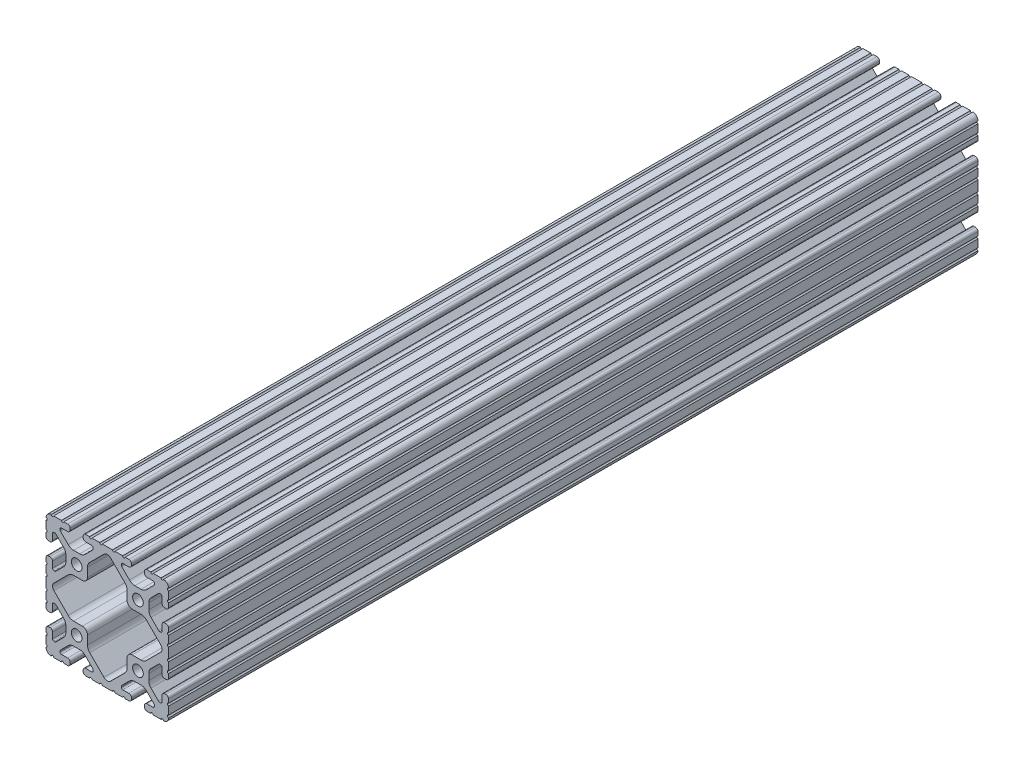
from build123d import *

# Parameters (mm, degrees)
SKETCH1_R           = 3.3274
BOSS_EXTRUDE1_DEPTH = 503.174


with BuildPart() as part:
    # Sketch1 → Boss-Extrude1 (new body)
    with BuildSketch(Plane.XY):
        with BuildLine():
            Line((-38.1, 3.2004), (-38.1, -3.2004))
            ThreePointArc((-38.1, -3.2004), (-37.338, -3.9624), (-38.1, -4.7244))
            Line((-38.1, -4.7244), (-38.1, -9.5504))
            ThreePointArc((-38.1, -9.5504), (-37.338, -10.3124), (-38.1, -11.0744))
            Line((-38.1, -11.0744), (-38.1, -13.4112))
            ThreePointArc((-38.1, -13.4112), (-37.638751759, -14.524751759), (-36.5252, -14.986))
            Line((-36.5252, -14.986), (-35.6108, -14.986))
            ThreePointArc((-35.6108, -14.986), (-34.497248241, -14.524751759), (-34.036, -13.4112))
            Line((-34.036, -13.4112), (-34.036, -9.652))
            ThreePointArc((-34.036, -9.652), (-33.775617928, -9.023382072), (-33.147, -8.763))
            Line((-33.147, -8.763), (-32.578918, -8.763))
            ThreePointArc((-32.578918, -8.763), (-32.238712428, -8.830671096), (-31.950300071, -9.023382072))
            Line((-31.950300071, -9.023382072), (-27.179198975, -13.794483168))
            ThreePointArc((-27.179198975, -13.794483168), (-26.14957176, -15.33542919), (-25.788014764, -17.153098957))
            Line((-25.788014764, -17.153098957), (-25.788014764, -20.946901043))
            ThreePointArc((-25.788014764, -20.946901043), (-26.14957176, -22.76457081), (-27.179198975, -24.305516832))
            Line((-27.179198975, -24.305516832), (-31.950300071, -29.076617928))
            ThreePointArc((-31.950300071, -29.076617928), (-32.238712428, -29.269328904), (-32.578918, -29.337))
            Line((-32.578918, -29.337), (-33.147, -29.337))
            ThreePointArc((-33.147, -29.337), (-33.775617928, -29.076617928), (-34.036, -28.448))
            Line((-34.036, -28.448), (-34.036, -24.6888))
            ThreePointArc((-34.036, -24.6888), (-34.497248241, -23.575248241), (-35.6108, -23.114))
            Line((-35.6108, -23.114), (-36.5252, -23.114))
            ThreePointArc((-36.5252, -23.114), (-37.638751759, -23.575248241), (-38.1, -24.6888))
            Line((-38.1, -24.6888), (-38.1, -27.0256))
            ThreePointArc((-38.1, -27.0256), (-37.338, -27.7876), (-38.1, -28.5496))
            Line((-38.1, -28.5496), (-38.1, -33.3756))
            ThreePointArc((-38.1, -33.3756), (-37.338, -34.1376), (-38.1, -34.8996))
            Line((-38.1, -34.8996), (-38.1, -34.925))
            ThreePointArc((-38.1, -34.925), (-37.17006403, -37.17006403), (-34.925, -38.1))
            Line((-34.925, -38.1), (-34.8996, -38.1))
            ThreePointArc((-34.8996, -38.1), (-34.1376, -37.338), (-33.3756, -38.1))
            Line((-33.3756, -38.1), (-28.5496, -38.1))
            ThreePointArc((-28.5496, -38.1), (-27.7876, -37.338), (-27.0256, -38.1))
            Line((-27.0256, -38.1), (-24.6888, -38.1))
            ThreePointArc((-24.6888, -38.1), (-23.575248241, -37.638751759), (-23.114, -36.5252))
            Line((-23.114, -36.5252), (-23.114, -35.6108))
            ThreePointArc((-23.114, -35.6108), (-23.575248241, -34.497248241), (-24.6888, -34.036))
            Line((-24.6888, -34.036), (-28.448, -34.036))
            ThreePointArc((-28.448, -34.036), (-29.076617928, -33.775617928), (-29.337, -33.147))
            Line((-29.337, -33.147), (-29.337, -32.578918))
            ThreePointArc((-29.337, -32.578918), (-29.269328904, -32.238712428), (-29.076617928, -31.950300071))
            Line((-29.076617928, -31.950300071), (-24.305516832, -27.179198975))
            ThreePointArc((-24.305516832, -27.179198975), (-22.76457081, -26.14957176), (-20.946901043, -25.788014764))
            Line((-20.946901043, -25.788014764), (-17.153098957, -25.788014764))
            ThreePointArc((-17.153098957, -25.788014764), (-15.33542919, -26.14957176), (-13.794483168, -27.179198975))
            Line((-13.794483168, -27.179198975), (-9.023382072, -31.950300071))
            ThreePointArc((-9.023382072, -31.950300071), (-8.830671096, -32.238712428), (-8.763, -32.578918))
            Line((-8.763, -32.578918), (-8.763, -33.147))
            ThreePointArc((-8.763, -33.147), (-9.023382072, -33.775617928), (-9.652, -34.036))
            Line((-9.652, -34.036), (-13.4112, -34.036))
            ThreePointArc((-13.4112, -34.036), (-14.524751759, -34.497248241), (-14.986, -35.6108))
            Line((-14.986, -35.6108), (-14.986, -36.5252))
            ThreePointArc((-14.986, -36.5252), (-14.524751759, -37.638751759), (-13.4112, -38.1))
            Line((-13.4112, -38.1), (-11.0744, -38.1))
            ThreePointArc((-11.0744, -38.1), (-10.3124, -37.338), (-9.5504, -38.1))
            Line((-9.5504, -38.1), (-4.7244, -38.1))
            ThreePointArc((-4.7244, -38.1), (-3.9624, -37.338), (-3.2004, -38.1))
            Line((-3.2004, -38.1), (3.2004, -38.1))
            ThreePointArc((3.2004, -38.1), (3.9624, -37.338), (4.7244, -38.1))
            Line((4.7244, -38.1), (9.5504, -38.1))
            ThreePointArc((9.5504, -38.1), (10.3124, -37.338), (11.0744, -38.1))
            Line((11.0744, -38.1), (13.4112, -38.1))
            ThreePointArc((13.4112, -38.1), (14.524751759, -37.638751759), (14.986, -36.5252))
            Line((14.986, -36.5252), (14.986, -35.6108))
            ThreePointArc((14.986, -35.6108), (14.524751759, -34.497248241), (13.4112, -34.036))
            Line((13.4112, -34.036), (9.652, -34.036))
            ThreePointArc((9.652, -34.036), (9.023382072, -33.775617928), (8.763, -33.147))
            Line((8.763, -33.147), (8.763, -32.578918))
            ThreePointArc((8.763, -32.578918), (8.830671096, -32.238712428), (9.023382072, -31.950300071))
            Line((9.023382072, -31.950300071), (13.794483168, -27.179198975))
            ThreePointArc((13.794483168, -27.179198975), (15.33542919, -26.14957176), (17.153098957, -25.788014764))
            Line((17.153098957, -25.788014764), (20.946901043, -25.788014764))
            ThreePointArc((20.946901043, -25.788014764), (22.76457081, -26.14957176), (24.305516832, -27.179198975))
            Line((24.305516832, -27.179198975), (29.076617928, -31.950300071))
            ThreePointArc((29.076617928, -31.950300071), (29.269328904, -32.238712428), (29.337, -32.578918))
            Line((29.337, -32.578918), (29.337, -33.147))
            ThreePointArc((29.337, -33.147), (29.076617928, -33.775617928), (28.448, -34.036))
            Line((28.448, -34.036), (24.6888, -34.036))
            ThreePointArc((24.6888, -34.036), (23.575248241, -34.497248241), (23.114, -35.6108))
            Line((23.114, -35.6108), (23.114, -36.5252))
            ThreePointArc((23.114, -36.5252), (23.575248241, -37.638751759), (24.6888, -38.1))
            Line((24.6888, -38.1), (27.0256, -38.1))
            ThreePointArc((27.0256, -38.1), (27.7876, -37.338), (28.5496, -38.1))
            Line((28.5496, -38.1), (33.3756, -38.1))
            ThreePointArc((33.3756, -38.1), (34.1376, -37.338), (34.8996, -38.1))
            Line((34.8996, -38.1), (34.925, -38.1))
            ThreePointArc((34.925, -38.1), (37.17006403, -37.17006403), (38.1, -34.925))
            Line((38.1, -34.925), (38.1, -34.8996))
            ThreePointArc((38.1, -34.8996), (37.338, -34.1376), (38.1, -33.3756))
            Line((38.1, -33.3756), (38.1, -28.5496))
            ThreePointArc((38.1, -28.5496), (37.338, -27.7876), (38.1, -27.0256))
            Line((38.1, -27.0256), (38.1, -24.6888))
            ThreePointArc((38.1, -24.6888), (37.638751759, -23.575248241), (36.5252, -23.114))
            Line((36.5252, -23.114), (35.6108, -23.114))
            ThreePointArc((35.6108, -23.114), (34.497248241, -23.575248241), (34.036, -24.6888))
            Line((34.036, -24.6888), (34.036, -28.448))
            ThreePointArc((34.036, -28.448), (33.775617928, -29.076617928), (33.147, -29.337))
            Line((33.147, -29.337), (32.578918, -29.337))
            ThreePointArc((32.578918, -29.337), (32.238712428, -29.269328904), (31.950300071, -29.076617928))
            Line((31.950300071, -29.076617928), (27.179198975, -24.305516832))
            ThreePointArc((27.179198975, -24.305516832), (26.14957176, -22.76457081), (25.788014764, -20.946901043))
            Line((25.788014764, -20.946901043), (25.788014764, -17.153098957))
            ThreePointArc((25.788014764, -17.153098957), (26.14957176, -15.33542919), (27.179198975, -13.794483168))
            Line((27.179198975, -13.794483168), (31.950300071, -9.023382072))
            ThreePointArc((31.950300071, -9.023382072), (32.238712428, -8.830671096), (32.578918, -8.763))
            Line((32.578918, -8.763), (33.147, -8.763))
            ThreePointArc((33.147, -8.763), (33.775617928, -9.023382072), (34.036, -9.652))
            Line((34.036, -9.652), (34.036, -13.4112))
            ThreePointArc((34.036, -13.4112), (34.497248241, -14.524751759), (35.6108, -14.986))
            Line((35.6108, -14.986), (36.5252, -14.986))
            ThreePointArc((36.5252, -14.986), (37.638751759, -14.524751759), (38.1, -13.4112))
            Line((38.1, -13.4112), (38.1, -11.0744))
            ThreePointArc((38.1, -11.0744), (37.338, -10.3124), (38.1, -9.5504))
            Line((38.1, -9.5504), (38.1, -4.7244))
            ThreePointArc((38.1, -4.7244), (37.338, -3.9624), (38.1, -3.2004))
            Line((38.1, -3.2004), (38.1, 3.2004))
            ThreePointArc((38.1, 3.2004), (37.338, 3.9624), (38.1, 4.7244))
            Line((38.1, 4.7244), (38.1, 9.5504))
            ThreePointArc((38.1, 9.5504), (37.338, 10.3124), (38.1, 11.0744))
            Line((38.1, 11.0744), (38.1, 13.4112))
            ThreePointArc((38.1, 13.4112), (37.638751759, 14.524751759), (36.5252, 14.986))
            Line((36.5252, 14.986), (35.6108, 14.986))
            ThreePointArc((35.6108, 14.986), (34.497248241, 14.524751759), (34.036, 13.4112))
            Line((34.036, 13.4112), (34.036, 9.652))
            ThreePointArc((34.036, 9.652), (33.775617928, 9.023382072), (33.147, 8.763))
            Line((33.147, 8.763), (32.578918, 8.763))
            ThreePointArc((32.578918, 8.763), (32.238712428, 8.830671096), (31.950300071, 9.023382072))
            Line((31.950300071, 9.023382072), (27.179198975, 13.794483168))
            ThreePointArc((27.179198975, 13.794483168), (26.14957176, 15.33542919), (25.788014764, 17.153098957))
            Line((25.788014764, 17.153098957), (25.788014764, 20.946901043))
            ThreePointArc((25.788014764, 20.946901043), (26.14957176, 22.76457081), (27.179198975, 24.305516832))
            Line((27.179198975, 24.305516832), (31.950300071, 29.076617928))
            ThreePointArc((31.950300071, 29.076617928), (32.238712428, 29.269328904), (32.578918, 29.337))
            Line((32.578918, 29.337), (33.147, 29.337))
            ThreePointArc((33.147, 29.337), (33.775617928, 29.076617928), (34.036, 28.448))
            Line((34.036, 28.448), (34.036, 24.6888))
            ThreePointArc((34.036, 24.6888), (34.497248241, 23.575248241), (35.6108, 23.114))
            Line((35.6108, 23.114), (36.5252, 23.114))
            ThreePointArc((36.5252, 23.114), (37.638751759, 23.575248241), (38.1, 24.6888))
            Line((38.1, 24.6888), (38.1, 27.0256))
            ThreePointArc((38.1, 27.0256), (37.338, 27.7876), (38.1, 28.5496))
            Line((38.1, 28.5496), (38.1, 33.3756))
            ThreePointArc((38.1, 33.3756), (37.338, 34.1376), (38.1, 34.8996))
            Line((38.1, 34.8996), (38.1, 34.925))
            ThreePointArc((38.1, 34.925), (37.17006403, 37.17006403), (34.925, 38.1))
            Line((34.925, 38.1), (34.8996, 38.1))
            ThreePointArc((34.8996, 38.1), (34.1376, 37.338), (33.3756, 38.1))
            Line((33.3756, 38.1), (28.5496, 38.1))
            ThreePointArc((28.5496, 38.1), (27.7876, 37.338), (27.0256, 38.1))
            Line((27.0256, 38.1), (24.6888, 38.1))
            ThreePointArc((24.6888, 38.1), (23.575248241, 37.638751759), (23.114, 36.5252))
            Line((23.114, 36.5252), (23.114, 35.6108))
            ThreePointArc((23.114, 35.6108), (23.575248241, 34.497248241), (24.6888, 34.036))
            Line((24.6888, 34.036), (28.448, 34.036))
            ThreePointArc((28.448, 34.036), (29.076617928, 33.775617928), (29.337, 33.147))
            Line((29.337, 33.147), (29.337, 32.578918))
            ThreePointArc((29.337, 32.578918), (29.269328904, 32.238712428), (29.076617928, 31.950300071))
            Line((29.076617928, 31.950300071), (24.305516832, 27.179198975))
            ThreePointArc((24.305516832, 27.179198975), (22.76457081, 26.14957176), (20.946901043, 25.788014764))
            Line((20.946901043, 25.788014764), (17.153098957, 25.788014764))
            ThreePointArc((17.153098957, 25.788014764), (15.33542919, 26.14957176), (13.794483168, 27.179198975))
            Line((13.794483168, 27.179198975), (9.023382072, 31.950300071))
            ThreePointArc((9.023382072, 31.950300071), (8.830671096, 32.238712428), (8.763, 32.578918))
            Line((8.763, 32.578918), (8.763, 33.147))
            ThreePointArc((8.763, 33.147), (9.023382072, 33.775617928), (9.652, 34.036))
            Line((9.652, 34.036), (13.4112, 34.036))
            ThreePointArc((13.4112, 34.036), (14.524751759, 34.497248241), (14.986, 35.6108))
            Line((14.986, 35.6108), (14.986, 36.5252))
            ThreePointArc((14.986, 36.5252), (14.524751759, 37.638751759), (13.4112, 38.1))
            Line((13.4112, 38.1), (11.0744, 38.1))
            ThreePointArc((11.0744, 38.1), (10.3124, 37.338), (9.5504, 38.1))
            Line((9.5504, 38.1), (4.7244, 38.1))
            ThreePointArc((4.7244, 38.1), (3.9624, 37.338), (3.2004, 38.1))
            Line((3.2004, 38.1), (-3.2004, 38.1))
            ThreePointArc((-3.2004, 38.1), (-3.9624, 37.338), (-4.7244, 38.1))
            Line((-4.7244, 38.1), (-9.5504, 38.1))
            ThreePointArc((-9.5504, 38.1), (-10.3124, 37.338), (-11.0744, 38.1))
            Line((-11.0744, 38.1), (-13.4112, 38.1))
            ThreePointArc((-13.4112, 38.1), (-14.524751759, 37.638751759), (-14.986, 36.5252))
            Line((-14.986, 36.5252), (-14.986, 35.6108))
            ThreePointArc((-14.986, 35.6108), (-14.524751759, 34.497248241), (-13.4112, 34.036))
            Line((-13.4112, 34.036), (-9.652, 34.036))
            ThreePointArc((-9.652, 34.036), (-9.023382072, 33.775617928), (-8.763, 33.147))
            Line((-8.763, 33.147), (-8.763, 32.578918))
            ThreePointArc((-8.763, 32.578918), (-8.830671096, 32.238712428), (-9.023382072, 31.950300071))
            Line((-9.023382072, 31.950300071), (-13.794483168, 27.179198975))
            ThreePointArc((-13.794483168, 27.179198975), (-15.33542919, 26.14957176), (-17.153098957, 25.788014764))
            Line((-17.153098957, 25.788014764), (-20.946901043, 25.788014764))
            ThreePointArc((-20.946901043, 25.788014764), (-22.76457081, 26.14957176), (-24.305516832, 27.179198975))
            Line((-24.305516832, 27.179198975), (-29.076617928, 31.950300071))
            ThreePointArc((-29.076617928, 31.950300071), (-29.269328904, 32.238712428), (-29.337, 32.578918))
            Line((-29.337, 32.578918), (-29.337, 33.147))
            ThreePointArc((-29.337, 33.147), (-29.076617928, 33.775617928), (-28.448, 34.036))
            Line((-28.448, 34.036), (-24.6888, 34.036))
            ThreePointArc((-24.6888, 34.036), (-23.575248241, 34.497248241), (-23.114, 35.6108))
            Line((-23.114, 35.6108), (-23.114, 36.5252))
            ThreePointArc((-23.114, 36.5252), (-23.575248241, 37.638751759), (-24.6888, 38.1))
            Line((-24.6888, 38.1), (-27.0256, 38.1))
            ThreePointArc((-27.0256, 38.1), (-27.7876, 37.338), (-28.5496, 38.1))
            Line((-28.5496, 38.1), (-33.3756, 38.1))
            ThreePointArc((-33.3756, 38.1), (-34.1376, 37.338), (-34.8996, 38.1))
            Line((-34.8996, 38.1), (-34.925, 38.1))
            ThreePointArc((-34.925, 38.1), (-37.17006403, 37.17006403), (-38.1, 34.925))
            Line((-38.1, 34.925), (-38.1, 34.8996))
            ThreePointArc((-38.1, 34.8996), (-37.338, 34.1376), (-38.1, 33.3756))
            Line((-38.1, 33.3756), (-38.1, 28.5496))
            ThreePointArc((-38.1, 28.5496), (-37.338, 27.7876), (-38.1, 27.0256))
            Line((-38.1, 27.0256), (-38.1, 24.6888))
            ThreePointArc((-38.1, 24.6888), (-37.638751759, 23.575248241), (-36.5252, 23.114))
            Line((-36.5252, 23.114), (-35.6108, 23.114))
            ThreePointArc((-35.6108, 23.114), (-34.497248241, 23.575248241), (-34.036, 24.6888))
            Line((-34.036, 24.6888), (-34.036, 28.448))
            ThreePointArc((-34.036, 28.448), (-33.775617928, 29.076617928), (-33.147, 29.337))
            Line((-33.147, 29.337), (-32.578918, 29.337))
            ThreePointArc((-32.578918, 29.337), (-32.238712428, 29.269328904), (-31.950300071, 29.076617928))
            Line((-31.950300071, 29.076617928), (-27.179198975, 24.305516832))
            ThreePointArc((-27.179198975, 24.305516832), (-26.14957176, 22.76457081), (-25.788014764, 20.946901043))
            Line((-25.788014764, 20.946901043), (-25.788014764, 17.153098957))
            ThreePointArc((-25.788014764, 17.153098957), (-26.14957176, 15.33542919), (-27.179198975, 13.794483168))
            Line((-27.179198975, 13.794483168), (-31.950300071, 9.023382072))
            ThreePointArc((-31.950300071, 9.023382072), (-32.238712428, 8.830671096), (-32.578918, 8.763))
            Line((-32.578918, 8.763), (-33.147, 8.763))
            ThreePointArc((-33.147, 8.763), (-33.775617928, 9.023382072), (-34.036, 9.652))
            Line((-34.036, 9.652), (-34.036, 13.4112))
            ThreePointArc((-34.036, 13.4112), (-34.497248241, 14.524751759), (-35.6108, 14.986))
            Line((-35.6108, 14.986), (-36.5252, 14.986))
            ThreePointArc((-36.5252, 14.986), (-37.638751759, 14.524751759), (-38.1, 13.4112))
            Line((-38.1, 13.4112), (-38.1, 11.0744))
            ThreePointArc((-38.1, 11.0744), (-37.338, 10.3124), (-38.1, 9.5504))
            Line((-38.1, 9.5504), (-38.1, 4.7244))
            ThreePointArc((-38.1, 4.7244), (-37.338, 3.9624), (-38.1, 3.2004))
        make_face()
        with Locations((-19.05, 19.05)):
            Circle(SKETCH1_R, mode=Mode.SUBTRACT)
        with Locations((-19.05, -19.05)):
            Circle(SKETCH1_R, mode=Mode.SUBTRACT)
        with Locations((19.05, -19.05)):
            Circle(SKETCH1_R, mode=Mode.SUBTRACT)
        with Locations((19.05, 19.05)):
            Circle(SKETCH1_R, mode=Mode.SUBTRACT)
        with BuildLine():
            Line((15.48698542, 12.311985236), (20.946901043, 12.311985236))
            ThreePointArc((20.946901043, 12.311985236), (22.76457081, 11.95042824), (24.305516832, 10.920801025))
            Line((24.305516832, 10.920801025), (33.160858949, 2.065458908))
            ThreePointArc((33.160858949, 2.065458908), (34.016400041, 0), (33.160858949, -2.065458908))
            Line((33.160858949, -2.065458908), (24.305516832, -10.920801025))
            ThreePointArc((24.305516832, -10.920801025), (22.76457081, -11.95042824), (20.946901043, -12.311985236))
            Line((20.946901043, -12.311985236), (15.48698542, -12.311985236))
            ThreePointArc((15.48698542, -12.311985236), (13.24192139, -13.241921206), (12.31198542, -15.486985236))
            Line((12.31198542, -15.486985236), (12.31198542, -20.946901043))
            ThreePointArc((12.31198542, -20.946901043), (11.950428424, -22.76457081), (10.920801209, -24.305516832))
            Line((10.920801209, -24.305516832), (2.065458908, -33.160859133))
            ThreePointArc((2.065458908, -33.160859133), (0, -34.016400226), (-2.065458908, -33.160859133))
            Line((-2.065458908, -33.160859133), (-10.920801209, -24.305516832))
            ThreePointArc((-10.920801209, -24.305516832), (-11.950428424, -22.76457081), (-12.31198542, -20.946901043))
            Line((-12.31198542, -20.946901043), (-12.31198542, -15.486985236))
            ThreePointArc((-12.31198542, -15.486985236), (-13.24192139, -13.241921206), (-15.48698542, -12.311985236))
            Line((-15.48698542, -12.311985236), (-20.946901043, -12.311985236))
            ThreePointArc((-20.946901043, -12.311985236), (-22.76457081, -11.95042824), (-24.305516832, -10.920801025))
            Line((-24.305516832, -10.920801025), (-33.160858949, -2.065458908))
            ThreePointArc((-33.160858949, -2.065458908), (-34.016400041, 0), (-33.160858949, 2.065458908))
            Line((-33.160858949, 2.065458908), (-24.305516832, 10.920801025))
            ThreePointArc((-24.305516832, 10.920801025), (-22.76457081, 11.95042824), (-20.946901043, 12.311985236))
            Line((-20.946901043, 12.311985236), (-15.48698542, 12.311985236))
            ThreePointArc((-15.48698542, 12.311985236), (-13.24192139, 13.241921206), (-12.31198542, 15.486985236))
            Line((-12.31198542, 15.486985236), (-12.31198542, 20.946901043))
            ThreePointArc((-12.31198542, 20.946901043), (-11.950428424, 22.76457081), (-10.920801209, 24.305516832))
            Line((-10.920801209, 24.305516832), (-2.065458908, 33.160859133))
            ThreePointArc((-2.065458908, 33.160859133), (0, 34.016400226), (2.065458908, 33.160859133))
            Line((2.065458908, 33.160859133), (10.920801209, 24.305516832))
            ThreePointArc((10.920801209, 24.305516832), (11.950428424, 22.76457081), (12.31198542, 20.946901043))
            Line((12.31198542, 20.946901043), (12.31198542, 15.486985236))
            ThreePointArc((12.31198542, 15.486985236), (13.24192139, 13.241921206), (15.48698542, 12.311985236))
        make_face(mode=Mode.SUBTRACT)
    extrude(amount=BOSS_EXTRUDE1_DEPTH)


solid = part.part
